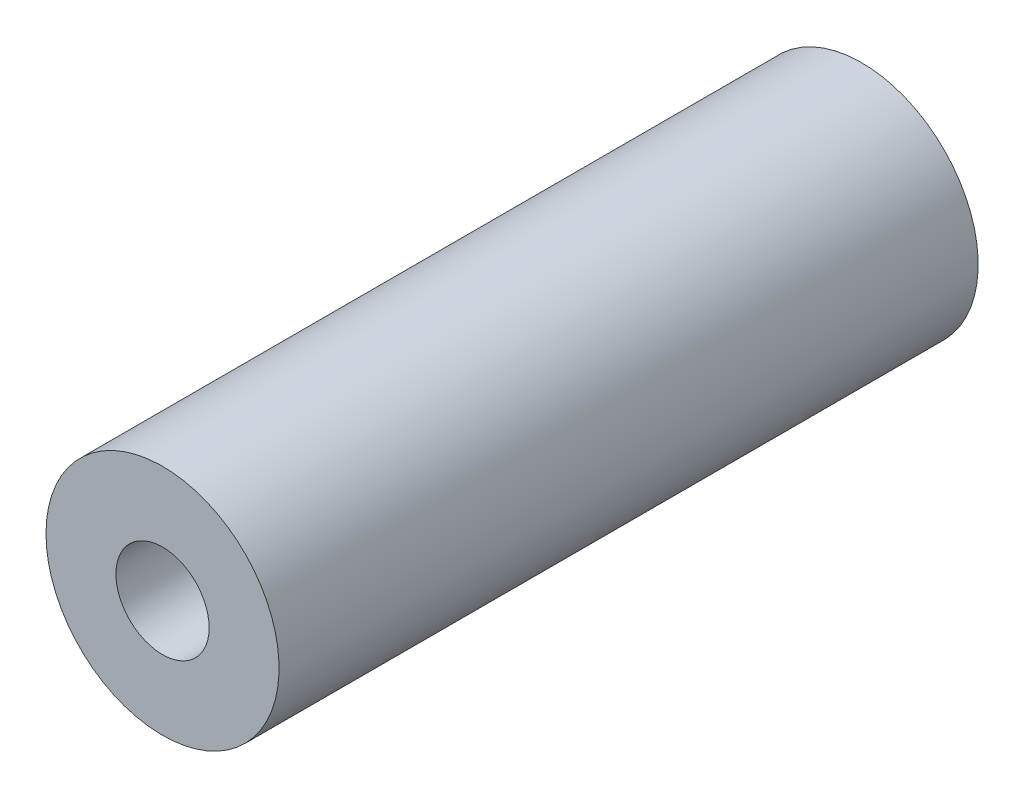
from build123d import *

# Parameters (mm, degrees)
SKETCH1_R           = 12.7
BOSS_EXTRUDE1_DEPTH = 76.2
SKETCH2_R           = 5.08
CUT_EXTRUDE1_DEPTH  = 12.7


with BuildPart() as part:
    # Sketch1 → Boss-Extrude1 (new body)
    with BuildSketch(Plane.XY):
        with Locations(Location((0, 0, 0), (0, 0, 180))):
            Circle(SKETCH1_R)
    extrude(amount=BOSS_EXTRUDE1_DEPTH)

    # Sketch2 → Cut-Extrude1 (cut)
    with BuildSketch(Plane.XY.offset(76.2)):
        Circle(SKETCH2_R)
    extrude(amount=-CUT_EXTRUDE1_DEPTH, mode=Mode.SUBTRACT)


solid = part.part
